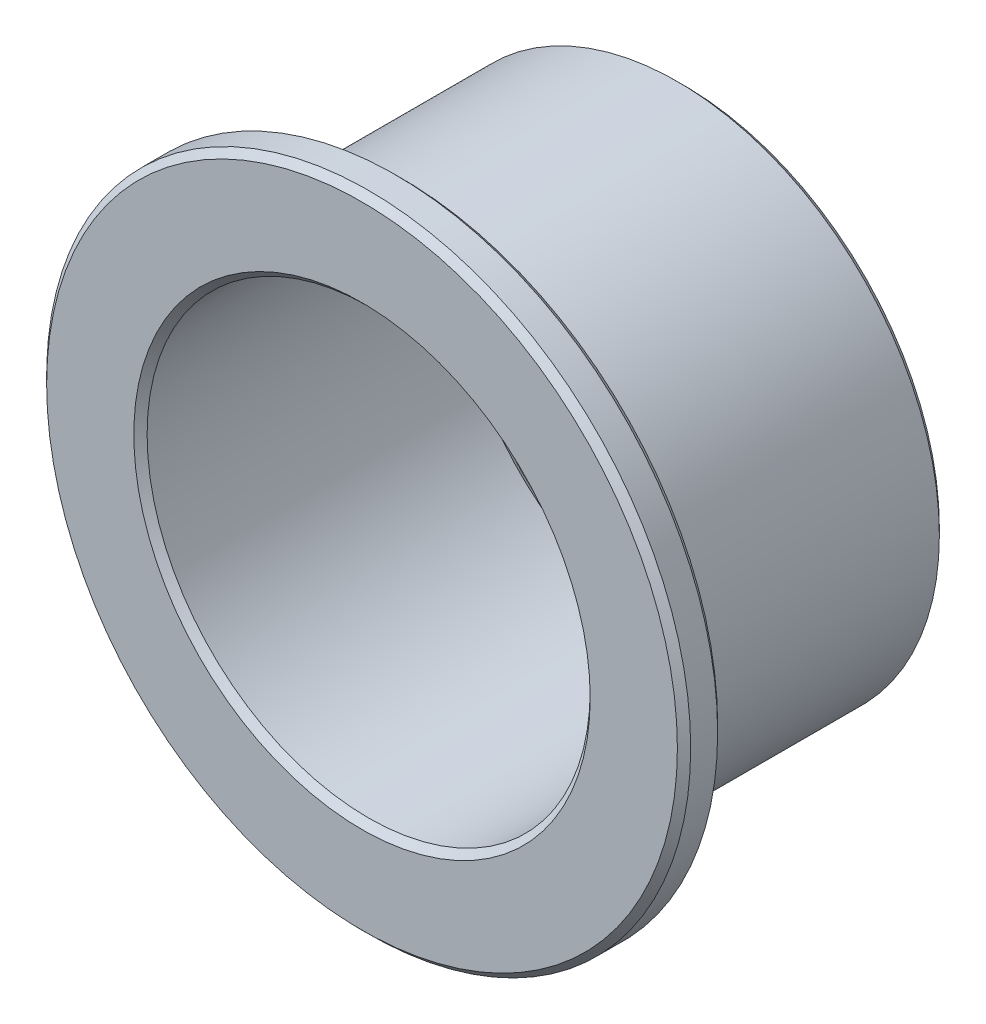
from build123d import *

# Parameters (mm, degrees)
BOSS_EXTRUDE1_START = 12.7
SKETCH3_R           = 25.4
SKETCH3_R_2         = 17.4752
BOSS_EXTRUDE1_DEPTH = 3.175
BOSS_EXTRUDE2_START = 9.525
SKETCH4_R           = 20.6629
SKETCH4_R_2         = 17.4752
BOSS_EXTRUDE2_DEPTH = 22.225
CHAMFER1_SIZE       = 0.524256


with BuildPart() as part:
    # Sketch3 → Boss-Extrude1 (new body)
    with BuildSketch(Plane.XY.offset(BOSS_EXTRUDE1_START)):
        Circle(SKETCH3_R)
        Circle(SKETCH3_R_2, mode=Mode.SUBTRACT)
    extrude(amount=-BOSS_EXTRUDE1_DEPTH)

    # Sketch4 → Boss-Extrude2 (add)
    with BuildSketch(Plane.XY.offset(BOSS_EXTRUDE2_START)):
        Circle(SKETCH4_R)
        Circle(SKETCH4_R_2, mode=Mode.SUBTRACT)
    extrude(amount=-BOSS_EXTRUDE2_DEPTH)

    # Chamfer1
    chamfer1_edges = [part.edges().sort_by_distance(p)[0] for p in [
        (-17.4752, 0, -12.7),
        (-20.6629, 0, 9.525),
        (-25.4, 0, 12.7),
        (-25.4, 0, 9.525),
        (-17.4752, 0, 12.7),
        (-20.6629, 0, -12.7),
    ]]
    chamfer(chamfer1_edges, length=CHAMFER1_SIZE)


solid = part.part
